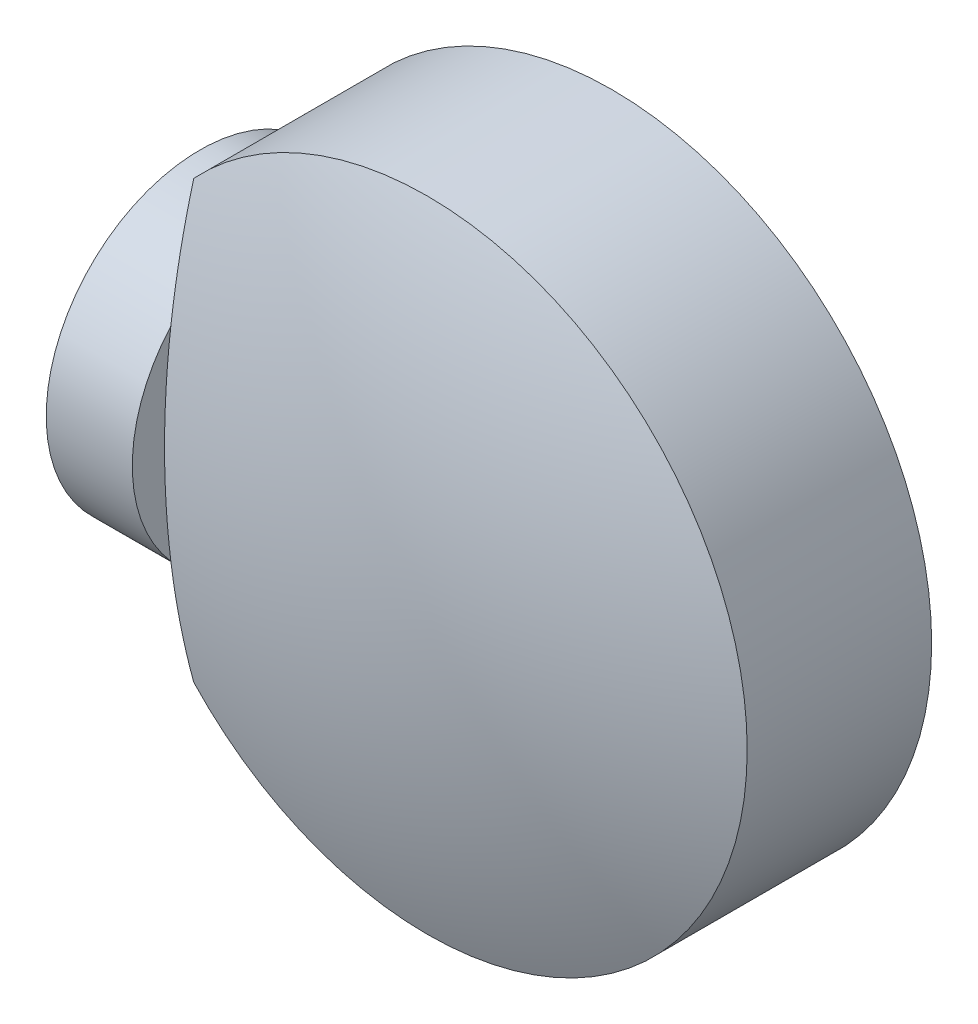
from build123d import *

# Parameters (mm, degrees)
ESQUISSE1_R           = 26
EXTRUSION1_DEPTH      = 15
D_ME1_FACE_RADIUS     = 26
D_ME1_HEIGHT          = 5
D_ME2_FACE_RADIUS     = 26
D_ME2_HEIGHT          = 5
EXTRUSION2_DEPTH      = 42.856899073
EXTRUSION2_DEPTH_BACK = 42.856899073
ESQUISSE2_W           = 16.897481419
ESQUISSE2_H           = 62.481047215
ESQUISSE3_R           = 12.5
EXTRUSION3_DEPTH      = 7


with BuildPart() as part:
    # Esquisse1 → Extrusion1 (new body)
    with BuildSketch(Plane.XY):
        Circle(ESQUISSE1_R)
    extrude(amount=EXTRUSION1_DEPTH)

    # Dôme1: a dome of height H over a round flat face of radius A is a cap of a sphere of radius (A * A + H * H) / (2 * H)
    d_me1_r = (D_ME1_FACE_RADIUS * D_ME1_FACE_RADIUS + D_ME1_HEIGHT * D_ME1_HEIGHT) / (2 * D_ME1_HEIGHT)
    d_me1_base = Plane((0, 0, 15), z_dir=(0, 0, 1))
    with Locations(d_me1_base.offset(D_ME1_HEIGHT - d_me1_r)):
        d_me1_ball = Sphere(d_me1_r, mode=Mode.PRIVATE)
    add(split(d_me1_ball, bisect_by=d_me1_base, keep=Keep.TOP, mode=Mode.PRIVATE))

    # Dôme2: a dome of height H over a round flat face of radius A is a cap of a sphere of radius (A * A + H * H) / (2 * H)
    d_me2_r = (D_ME2_FACE_RADIUS * D_ME2_FACE_RADIUS + D_ME2_HEIGHT * D_ME2_HEIGHT) / (2 * D_ME2_HEIGHT)
    d_me2_base = Plane((0, 0, 0), z_dir=(0, 0, -1))
    with Locations(d_me2_base.offset(D_ME2_HEIGHT - d_me2_r)):
        d_me2_ball = Sphere(d_me2_r, mode=Mode.PRIVATE)
    add(split(d_me2_ball, bisect_by=d_me2_base, keep=Keep.TOP, mode=Mode.PRIVATE))

    # Esquisse2 → Extrusion2 (cut, two sides: drawn at the far end of the back side and taken through both)
    with BuildSketch(Plane.XY.offset(-EXTRUSION2_DEPTH_BACK)):
        with Locations((-27.44874071, 0.855485378)):
            Rectangle(ESQUISSE2_W, ESQUISSE2_H)
    extrude(amount=EXTRUSION2_DEPTH + EXTRUSION2_DEPTH_BACK, mode=Mode.SUBTRACT)

    # Esquisse3 → Extrusion3 (add)
    with BuildSketch(Plane.ZY.offset(19)):
        with Locations(Location((7.5, -0.001760651, 0), (0, 0, 41.467990135))):
            Circle(ESQUISSE3_R)
    extrude(amount=EXTRUSION3_DEPTH)


solid = part.part
